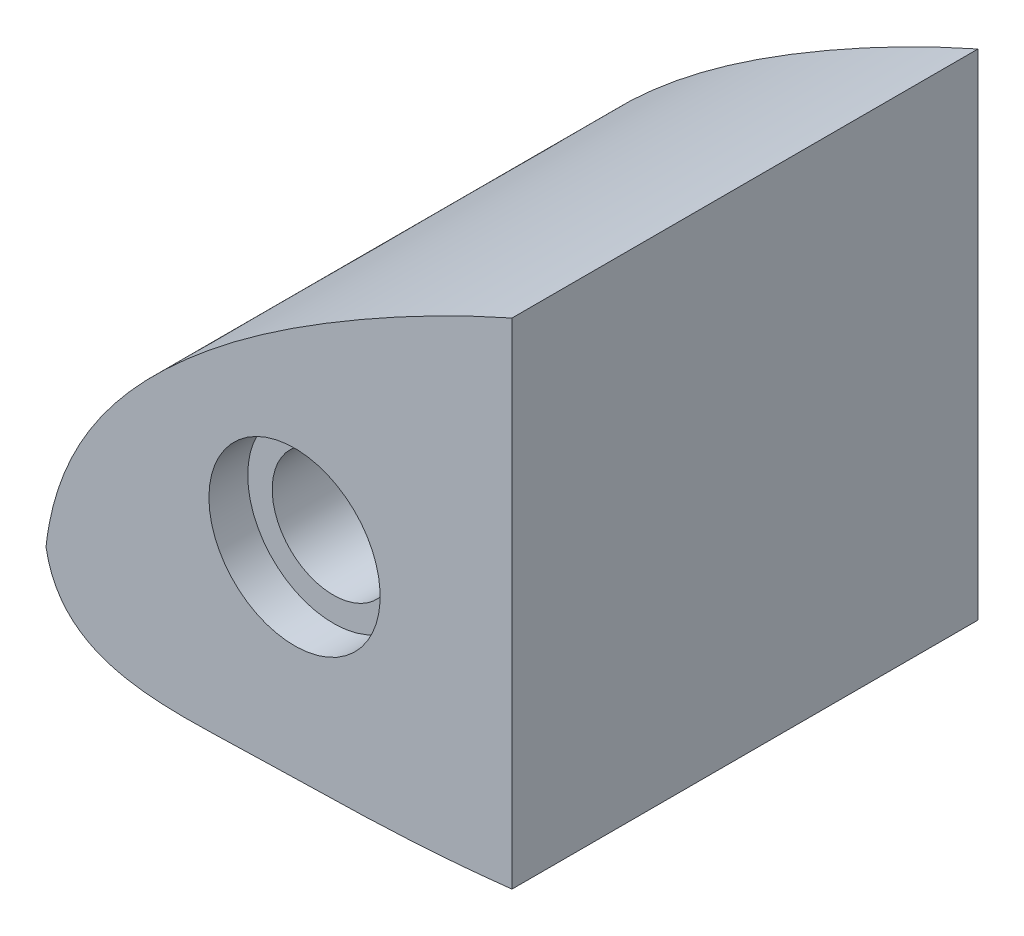
from build123d import *

# Parameters (mm, degrees)
BOSS_EXTRUDE1_DEPTH = 38.1
SKETCH2_R           = 5
SKETCH2_R_2         = 3.175
CUT_EXTRUDE1_DEPTH  = 319.018514003
SKETCH3_W           = 293.188888759
SKETCH3_H           = 137.971241769
CUT_EXTRUDE2_DEPTH  = 319.018514003
CUT_EXTRUDE3_START  = -38.1
SKETCH4_R           = 7
CUT_EXTRUDE3_DEPTH  = 3.175


with BuildPart() as part:
    # Sketch1 → Boss-Extrude1 (new body)
    with BuildSketch(Plane.XY):
        with BuildLine():
            add(Edge.make_bspline(
                [(0.000560351, 0.000130087), (0.810633127, 7.359196055), (8.649092025, 17.856605174), (26.286719818, 29.975176328), (52.111128271, 42.069215275), (89.597618475, 49.290763054), (131.400792109, 47.884831915), (173.256699242, 40.041104278), (217.961060472, 29.612974894), (256.952064401, 19.528920948), (290.35983767, 8.71099439), (301.273197721, 4.382828139), (314.816918223, -0.516206742), (309.846313895, 0.000130087)],
                knots=[0, 0, 0, 0, 0.060863618, 0.113688265, 0.188608742, 0.312908923, 0.448482434, 0.557612135, 0.691544113, 0.852438279, 0.92975597, 0.976058229, 1, 1, 1, 1], degree=3))
            add(Edge.make_bspline(
                [(309.846313895, 0.000130087), (303.956832565, 1.47095521), (293.989507544, 2.093987313), (276.26402299, 4.514356704), (260.846344817, 5.427413394), (235.858814759, 7.870306192), (205.101424636, 8.838080282), (157.718638092, 9.030650149), (110.497331172, 6.181495223), (66.506197185, -0.586669107), (36.454672816, -6.098499901), (15.316603331, -6.189065841), (1.230714189, -6.924076091), (0.000560351, 0.000130087)],
                knots=[0, 0, 0, 0, 0.057787081, 0.095274891, 0.171021118, 0.205339302, 0.335319146, 0.464904334, 0.658702312, 0.785511947, 0.893517288, 0.94309214, 1, 1, 1, 1], degree=3))
        make_face()
    extrude(amount=BOSS_EXTRUDE1_DEPTH)

    # Sketch2 → Cut-Extrude1 (cut, through all)
    with BuildSketch(Plane.XY.offset(38.1)):
        with Locations((20.32, 10.16)):
            Circle(SKETCH2_R)
        with Locations((227.296313895, 19.050130087)):
            Circle(SKETCH2_R_2)
    extrude(amount=-CUT_EXTRUDE1_DEPTH, mode=Mode.SUBTRACT)

    # Sketch3 → Cut-Extrude2 (cut, through all)
    with BuildSketch(Plane.XY.offset(38.1)):
        with Locations((184.69444438, 2.732377951)):
            Rectangle(SKETCH3_W, SKETCH3_H)
    extrude(amount=-CUT_EXTRUDE2_DEPTH, mode=Mode.SUBTRACT)

    # Sketch4 → Cut-Extrude3 (cut)
    with BuildSketch(Plane(origin=(0, 0, 0), x_dir=(-1, 0, 0), z_dir=(0, 0, -1)).offset(CUT_EXTRUDE3_START)):
        with Locations((-20.32, 10.16)):
            Circle(SKETCH4_R)
    extrude(amount=CUT_EXTRUDE3_DEPTH, mode=Mode.SUBTRACT)


solid = part.part
